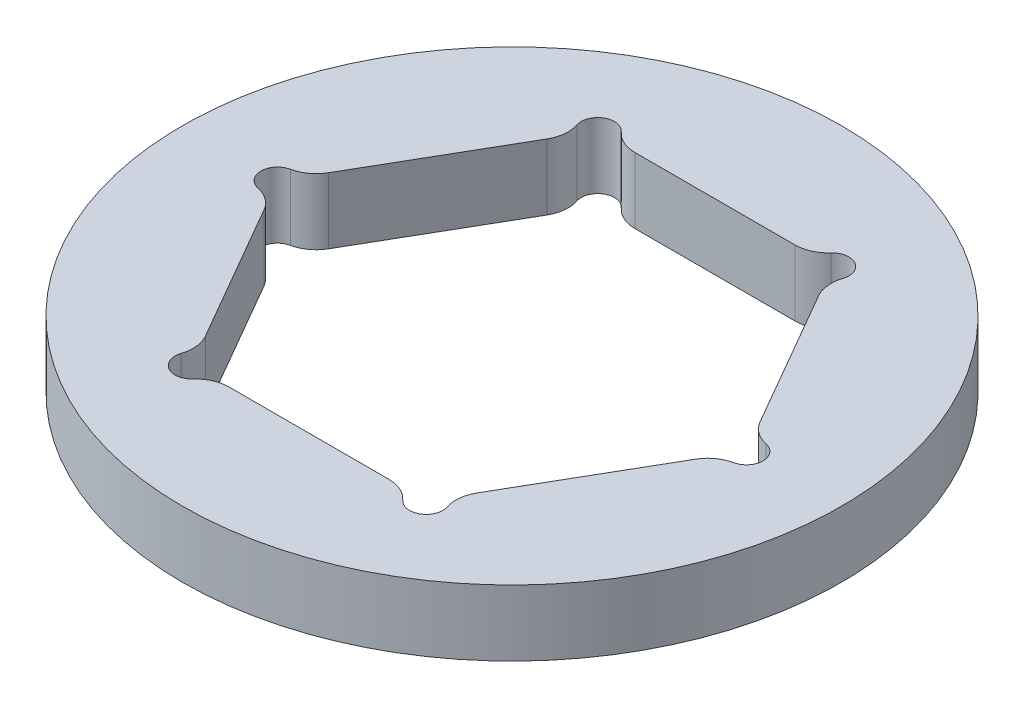
from build123d import *

# Parameters (mm, degrees)
CROQUIS1_R              = 7.9375
SALIENTE_EXTRUIR1_DEPTH = 0.79375


with BuildPart() as part:
    # Croquis1 → Saliente-Extruir1 (new, symmetric)
    with BuildSketch(Plane(origin=(0, 0, 0), x_dir=(1, 0, 0), z_dir=(0, 1, 0))):
        with Locations(Location((0, 0, 0), (0, 0, 270))):
            Circle(CROQUIS1_R)
        with BuildLine():
            Line((3.270167737, -4.114903331), (5.198694687, -0.774596669))
            ThreePointArc((5.198694687, -0.774596669), (5.422358794, -0.526605585), (5.727777192, -0.391532223))
            ThreePointArc((5.727777192, -0.391532223), (6.045908282, 0), (5.727777192, 0.391532223))
            ThreePointArc((5.727777192, 0.391532223), (5.422358794, 0.526605585), (5.198694687, 0.774596669))
            Line((5.198694687, 0.774596669), (3.270167737, 4.114903331))
            ThreePointArc((3.270167737, 4.114903331), (3.167233212, 4.432597672), (3.202965447, 4.764634444))
            ThreePointArc((3.202965447, 4.764634444), (3.022954141, 5.235910162), (2.524811744, 5.156166667))
            ThreePointArc((2.524811744, 5.156166667), (2.255125583, 4.959203257), (1.92852695, 4.8895))
            Line((1.92852695, 4.8895), (-1.92852695, 4.8895))
            ThreePointArc((-1.92852695, 4.8895), (-2.255125583, 4.959203257), (-2.524811744, 5.156166667))
            ThreePointArc((-2.524811744, 5.156166667), (-3.022954141, 5.235910162), (-3.202965447, 4.764634444))
            ThreePointArc((-3.202965447, 4.764634444), (-3.167233212, 4.432597672), (-3.270167737, 4.114903331))
            Line((-3.270167737, 4.114903331), (-5.198694687, 0.774596669))
            ThreePointArc((-5.198694687, 0.774596669), (-5.422358794, 0.526605585), (-5.727777192, 0.391532223))
            ThreePointArc((-5.727777192, 0.391532223), (-6.045908282, 0), (-5.727777192, -0.391532223))
            ThreePointArc((-5.727777192, -0.391532223), (-5.422358794, -0.526605585), (-5.198694687, -0.774596669))
            Line((-5.198694687, -0.774596669), (-3.270167737, -4.114903331))
            ThreePointArc((-3.270167737, -4.114903331), (-3.167233212, -4.432597672), (-3.202965447, -4.764634444))
            ThreePointArc((-3.202965447, -4.764634444), (-3.022954141, -5.235910162), (-2.524811744, -5.156166667))
            ThreePointArc((-2.524811744, -5.156166667), (-2.255125583, -4.959203257), (-1.92852695, -4.8895))
            Line((-1.92852695, -4.8895), (1.92852695, -4.8895))
            ThreePointArc((1.92852695, -4.8895), (2.255125583, -4.959203257), (2.524811744, -5.156166667))
            ThreePointArc((2.524811744, -5.156166667), (3.022954141, -5.235910162), (3.202965447, -4.764634444))
            ThreePointArc((3.202965447, -4.764634444), (3.167233212, -4.432597672), (3.270167737, -4.114903331))
        make_face(mode=Mode.SUBTRACT)
    extrude(amount=SALIENTE_EXTRUIR1_DEPTH, both=True)


solid = part.part
